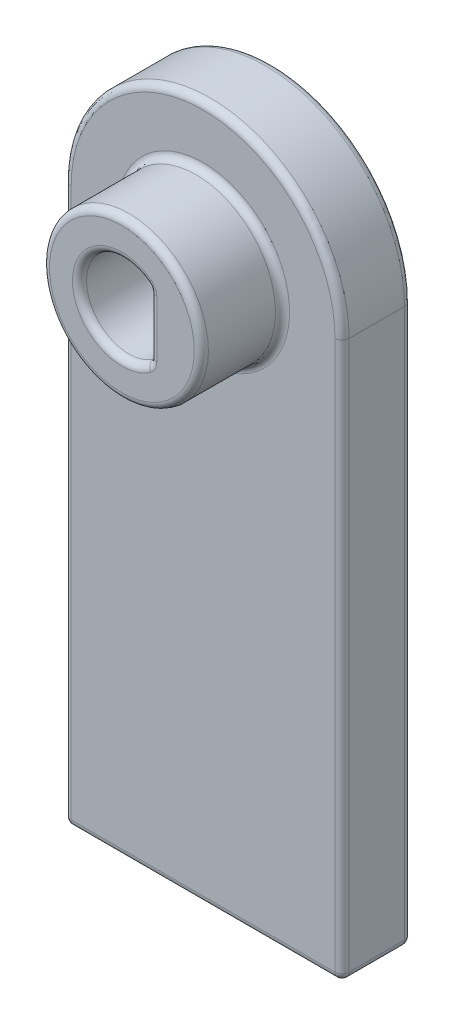
from build123d import *

# Parameters (mm, degrees)
BOSS_EXTRUDE1_DEPTH = 5
SKETCH2_R           = 5.715
BOSS_EXTRUDE2_DEPTH = 5.842
CUT_EXTRUDE1_REACH  = 43.643
FILLET1_R           = 0.508


with BuildPart() as part:
    # Sketch1 → Boss-Extrude1 (new body)
    with BuildSketch(Plane.XY):
        with BuildLine():
            Line((-10, 0), (-10, -40))
            Line((-10, -40), (10, -40))
            Line((10, -40), (10, 0))
            ThreePointArc((10, 0), (0, 10), (-10, 0))
        make_face()
    extrude(amount=BOSS_EXTRUDE1_DEPTH)

    # Sketch2 → Boss-Extrude2 (add)
    with BuildSketch(Plane.XY.offset(5)):
        with Locations(Location((0, 0, 0), (0, 0, 180))):
            Circle(SKETCH2_R)
        with BuildLine():
            Line((2.003122562, 2.3), (2.003122562, -2.3))
            ThreePointArc((2.003122562, -2.3), (-3.05, 0), (2.003122562, 2.3))
        make_face(mode=Mode.SUBTRACT)
    extrude(amount=BOSS_EXTRUDE2_DEPTH)

    # Sketch3 → Cut-Extrude1 (cut, up to next)
    with BuildSketch(Plane.XY.offset(5), mode=Mode.PRIVATE) as cut_extrude1_sk1:
        with BuildLine():
            Line((2.003122562, 2.3), (2.003122562, -2.3))
            ThreePointArc((2.003122562, -2.3), (-3.05, 0), (2.003122562, 2.3))
        make_face()
    cut_extrude1_tool1 = extrude(cut_extrude1_sk1.sketch, amount=-CUT_EXTRUDE1_REACH, mode=Mode.PRIVATE) & part.part
    add(cut_extrude1_tool1.solids().sort_by_distance((-0.313362, 0, 5))[0], mode=Mode.SUBTRACT)

    # Fillet1
    fillet1_edges = [part.edges().sort_by_distance(p)[0] for p in [
        (0, -40, 5),
        (5.715, 0, 5),
        (5.715, 0, 10.842),
        (10, -20, 5),
        (-3.05, 0, 10.842),
        (2.003122562, -2.3, 5.421),
        (2.003122562, 0, 10.842),
        (2.003122562, 2.3, 5.421),
        (-3.05, 0, 0),
        (2.003122562, 0, 0),
        (0, 10, 5),
        (10, -20, 0),
        (0, -40, 0),
        (-10, -20, 0),
        (0, 10, 0),
        (10, -40, 2.5),
        (-10, -40, 2.5),
        (-10, -20, 5),
    ]]
    fillet(fillet1_edges, radius=FILLET1_R)


solid = part.part
